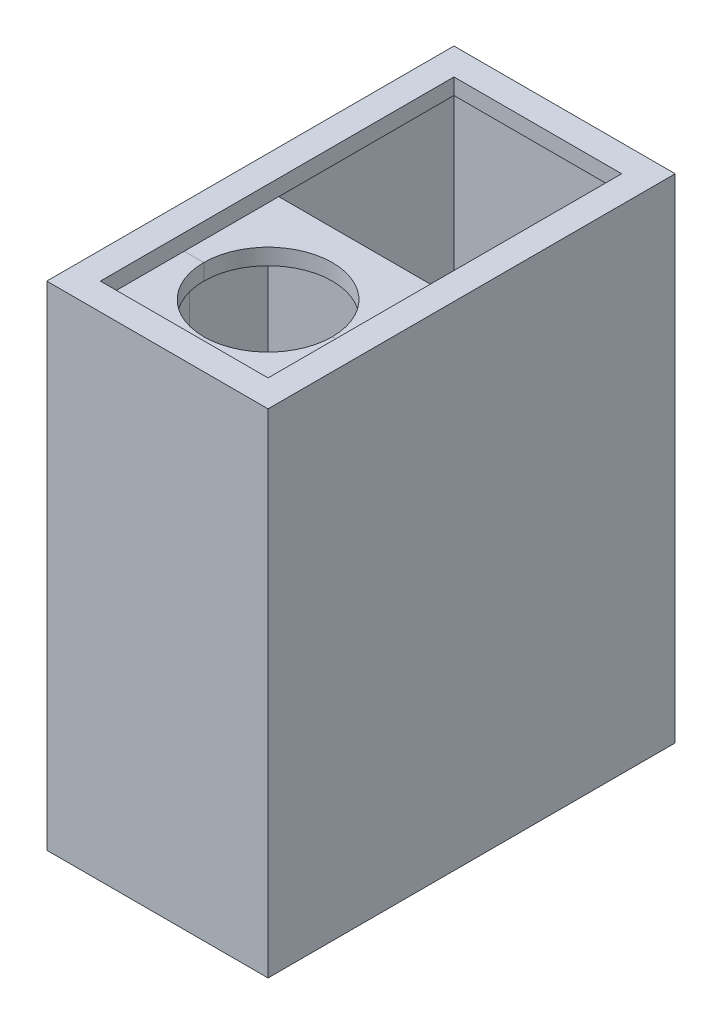
from build123d import *

# Parameters (mm, degrees)
SKETCH1_W              = 35.3
SKETCH1_H              = 35.3
SKETCH1_W_2            = 29.3
SKETCH1_H_2            = 29.3
EXTRUDE_THIN1_DEPTH    = 20
SKETCH2_W              = 35.3
SKETCH2_H              = 35.3
BOSS_EXTRUDE3_DEPTH    = 3
SKETCH3_W              = 10
SKETCH3_H              = 3
CUT_EXTRUDE1_DEPTH     = 3
SKETCH5_W              = 35.3
SKETCH5_H              = 35.3
SKETCH5_W_2            = 29.3
SKETCH5_H_2            = 29.3
EXTRUDE_THIN2_DEPTH    = 60
SKETCH6_W              = 35.3
SKETCH6_H              = 35.3
BOSS_EXTRUDE4_DEPTH    = 3
SKETCH7_R              = 12
CUT_EXTRUDE2_DEPTH     = 3
SPLIT1_SURFACE_1_BACK  = 100.439
SPLIT1_SURFACE_1_DEPTH = 200.878
SPLIT1_SURFACE_2_BACK  = 100.439
SPLIT1_SURFACE_2_DEPTH = 200.878
SKETCH10_W             = 41.3
SKETCH10_H             = 92
SKETCH10_W_2           = 35.3
SKETCH10_H_2           = 86
EXTRUDE_THIN4_DEPTH    = 70
SKETCH15_W             = 41.3
SKETCH15_H             = 92
BOSS_EXTRUDE7_DEPTH    = 3
SKETCH16_W             = 41.3
SKETCH16_H             = 92
BOSS_EXTRUDE8_DEPTH    = 3
SKETCH17_W             = 31.3
SKETCH17_H             = 66
CUT_EXTRUDE6_DEPTH     = 3


with BuildPart() as part:
    # Sketch1 → Extrude-Thin1 (new body)
    with BuildSketch(Plane(origin=(0, 0, 0), x_dir=(1, 0, 0), z_dir=(0, 1, 0))):
        Rectangle(SKETCH1_W, SKETCH1_H)
        Rectangle(SKETCH1_W_2, SKETCH1_H_2, mode=Mode.SUBTRACT)
    extrude(amount=EXTRUDE_THIN1_DEPTH)

    # Sketch3 → Cut-Extrude1 (cut)
    with BuildSketch(Plane(origin=(17.65, 0, 0), x_dir=(0, 0, -1), z_dir=(1, 0, 0))):
        with Locations((0, 4.5)):
            Rectangle(SKETCH3_W, SKETCH3_H)
    extrude(amount=-CUT_EXTRUDE1_DEPTH, mode=Mode.SUBTRACT)


with BuildPart() as body_2:
    # Sketch2 → Boss-Extrude3 (new body)
    with BuildSketch(Plane.XZ):
        Rectangle(SKETCH2_W, SKETCH2_H)
    extrude(amount=BOSS_EXTRUDE3_DEPTH)


with BuildPart() as body_3:
    # Sketch5 → Extrude-Thin2 (new body)
    with BuildSketch(Plane(origin=(0, 20, 0), x_dir=(1, 0, 0), z_dir=(0, 1, 0))):
        Rectangle(SKETCH5_W, SKETCH5_H)
        Rectangle(SKETCH5_W_2, SKETCH5_H_2, mode=Mode.SUBTRACT)
    extrude(amount=EXTRUDE_THIN2_DEPTH)

    # Sketch6 → Boss-Extrude4 (add)
    with BuildSketch(Plane(origin=(0, 80, 0), x_dir=(1, 0, 0), z_dir=(0, 1, 0))):
        Rectangle(SKETCH6_W, SKETCH6_H)
    extrude(amount=BOSS_EXTRUDE4_DEPTH)

    # Sketch7 → Cut-Extrude2 (cut)
    with BuildSketch(Plane(origin=(0, 83, 0), x_dir=(1, 0, 0), z_dir=(0, 1, 0))):
        with Locations(Location((0, 0, 0), (0, 0, 270))):
            Circle(SKETCH7_R)
    extrude(amount=-CUT_EXTRUDE2_DEPTH, mode=Mode.SUBTRACT)


with BuildPart() as body_4:
    # Split1: the piece behind the surface
    add(body_3.part)
    # Split1 surface: a surface, the sketch's curves swept straight by 200.878 mm
    with BuildLine(Plane.ZY.offset(17.65).offset(-SPLIT1_SURFACE_1_BACK), mode=Mode.PRIVATE) as split1_surface_1_path:
        Line((0, 83), (0, 20))
    split1_surface_1 = Shell.extrude(split1_surface_1_path.wire(), (-1 * SPLIT1_SURFACE_1_DEPTH, 0 * SPLIT1_SURFACE_1_DEPTH, 0 * SPLIT1_SURFACE_1_DEPTH))
    split(bisect_by=split1_surface_1, keep=Keep.BOTTOM)


with BuildPart() as body_3_1:
    add(body_3.part)

    # Split1: split by a surface, the side it looks to stays
    # Split1 surface: a surface, the sketch's curves swept straight by 200.878 mm
    with BuildLine(Plane.ZY.offset(17.65).offset(-SPLIT1_SURFACE_2_BACK), mode=Mode.PRIVATE) as split1_surface_2_path:
        Line((0, 83), (0, 20))
    split1_surface_2 = Shell.extrude(split1_surface_2_path.wire(), (-1 * SPLIT1_SURFACE_2_DEPTH, 0 * SPLIT1_SURFACE_2_DEPTH, 0 * SPLIT1_SURFACE_2_DEPTH))
    split(bisect_by=split1_surface_2, keep=Keep.TOP)


with BuildPart() as body_5:
    # Sketch10 → Extrude-Thin4 (new body)
    with BuildSketch(Plane.XY.offset(17.65)):
        with Locations((0, 40)):
            Rectangle(SKETCH10_W, SKETCH10_H)
        with Locations((0, 40)):
            Rectangle(SKETCH10_W_2, SKETCH10_H_2, mode=Mode.SUBTRACT)
    extrude(amount=-EXTRUDE_THIN4_DEPTH)

    # Sketch15 → Boss-Extrude7 (add)
    with BuildSketch(Plane.XY.offset(17.65)):
        with Locations((0, 40)):
            Rectangle(SKETCH15_W, SKETCH15_H)
    extrude(amount=BOSS_EXTRUDE7_DEPTH)

    # Sketch16 → Boss-Extrude8 (add)
    with BuildSketch(Plane(origin=(0, 0, -52.35), x_dir=(-1, 0, 0), z_dir=(0, 0, -1))):
        with Locations((0, 40)):
            Rectangle(SKETCH16_W, SKETCH16_H)
    extrude(amount=BOSS_EXTRUDE8_DEPTH)

    # Sketch17 → Cut-Extrude6 (cut)
    with BuildSketch(Plane(origin=(0, 86, 0), x_dir=(1, 0, 0), z_dir=(0, 1, 0))):
        with Locations((0, 17.35)):
            Rectangle(SKETCH17_W, SKETCH17_H)
    extrude(amount=-CUT_EXTRUDE6_DEPTH, mode=Mode.SUBTRACT)


solid = Compound([part.part, body_2.part, body_4.part, body_3_1.part, body_5.part])
